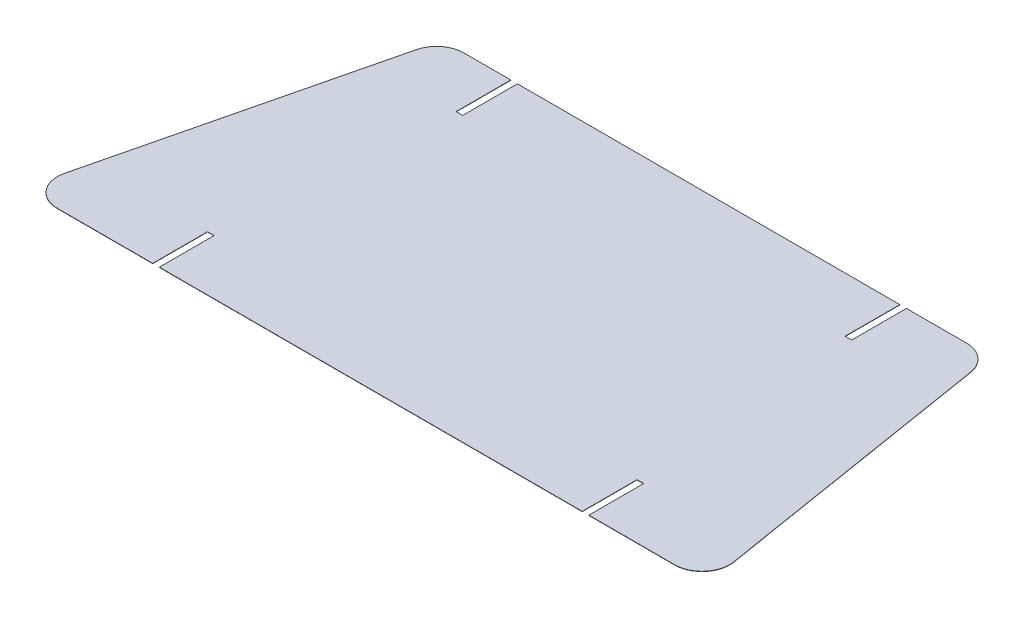
from build123d import *

# Parameters (mm, degrees)
BOSS_EXTRUDE1_DEPTH = 0.02


with BuildPart() as part:
    # Parametric Corte Laser → Boss-Extrude1 (new body)
    with BuildSketch(Plane(origin=(0, 0, 0), x_dir=(1, 0, 0), z_dir=(0, 1, 0))):
        with BuildLine():
            ThreePointArc((-24.399182899, -9.859654755), (-24.028101077, -11.567952641), (-22.455748148, -12.331948487))
            Line((-22.455748148, -12.331948487), (-15.482, -12.331948487))
            Line((-15.482, -12.331948487), (-15.482, -8.331948487))
            Line((-15.482, -8.331948487), (-15, -8.331948487))
            Line((-15, -8.331948487), (-15, -12.331948487))
            Line((-15, -12.331948487), (15.893230755, -12.331948487))
            Line((15.893230755, -12.331948487), (15.893230755, -8.331948487))
            Line((15.893230755, -8.331948487), (16.375230755, -8.331948487))
            Line((16.375230755, -8.331948487), (16.375230755, -12.331948487))
            Line((16.375230755, -12.331948487), (22.649443378, -12.331948487))
            ThreePointArc((22.649443378, -12.331948487), (24.172673665, -11.628007704), (24.62364003, -10.01171798))
            Line((24.62364003, -10.01171798), (21.269590724, 10.665740175))
            ThreePointArc((21.269590724, 10.665740175), (20.591453289, 11.868739955), (19.295394072, 12.345509668))
            Line((19.295394072, 12.345509668), (14.896112094, 12.345509668))
            Line((14.896112094, 12.345509668), (14.896112094, 8.345509668))
            Line((14.896112094, 8.345509668), (14.414112094, 8.345509668))
            Line((14.414112094, 8.345509668), (14.414112094, 12.345509668))
            Line((14.414112094, 12.345509668), (-13.52088134, 12.345509668))
            Line((-13.52088134, 12.345509668), (-13.52088134, 8.345509668))
            Line((-13.52088134, 8.345509668), (-14.00288134, 8.345509668))
            Line((-14.00288134, 8.345509668), (-14.00288134, 12.345509668))
            Line((-14.00288134, 12.345509668), (-17.430709938, 12.345509668))
            ThreePointArc((-17.430709938, 12.345509668), (-18.666714092, 11.917862596), (-19.374144689, 10.8178034))
            Line((-19.374144689, 10.8178034), (-24.399182899, -9.859654755))
        make_face()
    extrude(amount=BOSS_EXTRUDE1_DEPTH)


solid = part.part
